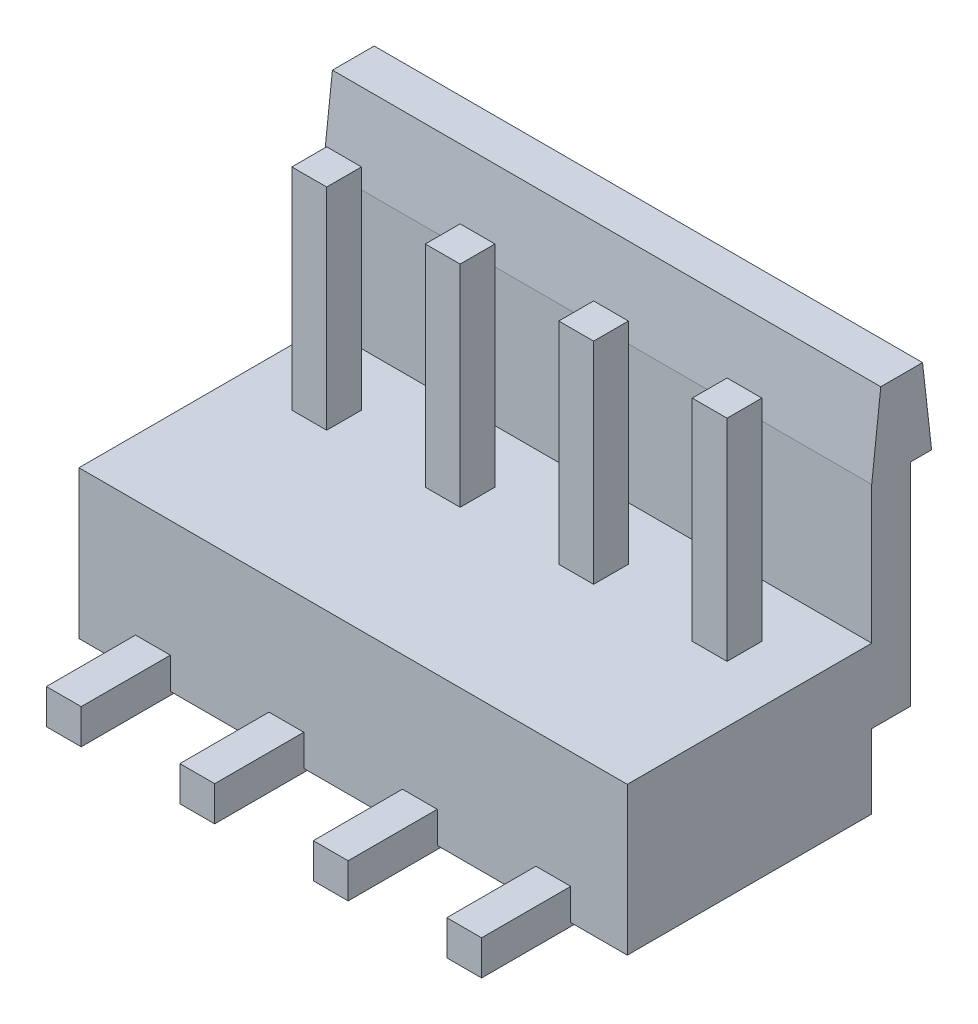
from build123d import *

# Parameters (mm, degrees)
SKETCH2_W           = 7.02
SKETCH2_H           = 4.25
BOSS_EXTRUDE1_DEPTH = 7.875
SKETCH4_W           = 1
SKETCH4_H           = 1
LPATTERN1_COUNT     = 4
LPATTERN1_PITCH     = 3.833333333


with BuildPart() as part:
    # Sketch2 → Boss-Extrude1 (new, symmetric)
    with BuildSketch(Plane(origin=(0, 0, 0), x_dir=(0, 0, -1), z_dir=(1, 0, 0))):
        with Locations((-3.51, -2.125)):
            Rectangle(SKETCH2_W, SKETCH2_H)
        Polygon((0, 3.95), (0, 0), (0, -2.125), (1.12, -2.125), (1.12, 3.95), (1.72, 3.95), (1.46, 6.25), (0.26, 6.25), align=None)
    extrude(amount=BOSS_EXTRUDE1_DEPTH, both=True)

    # Sweep1: sweep along a path in Sketch3
    with BuildLine(Plane(origin=(5.75, 0, 0), x_dir=(0, 0, -1), z_dir=(1, 0, 0))) as sweep1_path:
        Line((-2.03, 6.05), (-2.03, -1.85))
        ThreePointArc((-2.03, -1.85), (-2.615786438, -3.264213562), (-4.03, -3.85))
        Line((-4.03, -3.85), (-9.58, -3.85))
    # Sketch4 → Sweep1 (sweep)
    with BuildSketch(Plane(origin=(0, 6.05, 0), x_dir=(1, 0, 0), z_dir=(0, 1, 0))):
        with Locations((5.75, -2.03)):
            Rectangle(SKETCH4_W, SKETCH4_H)
    sweep1 = sweep(path=sweep1_path.line)

    # LPattern1: Sweep1 ×4
    with Locations(*[(-i * LPATTERN1_PITCH, 0, 0) for i in range(1, LPATTERN1_COUNT)]):
        add(sweep1)


solid = part.part
